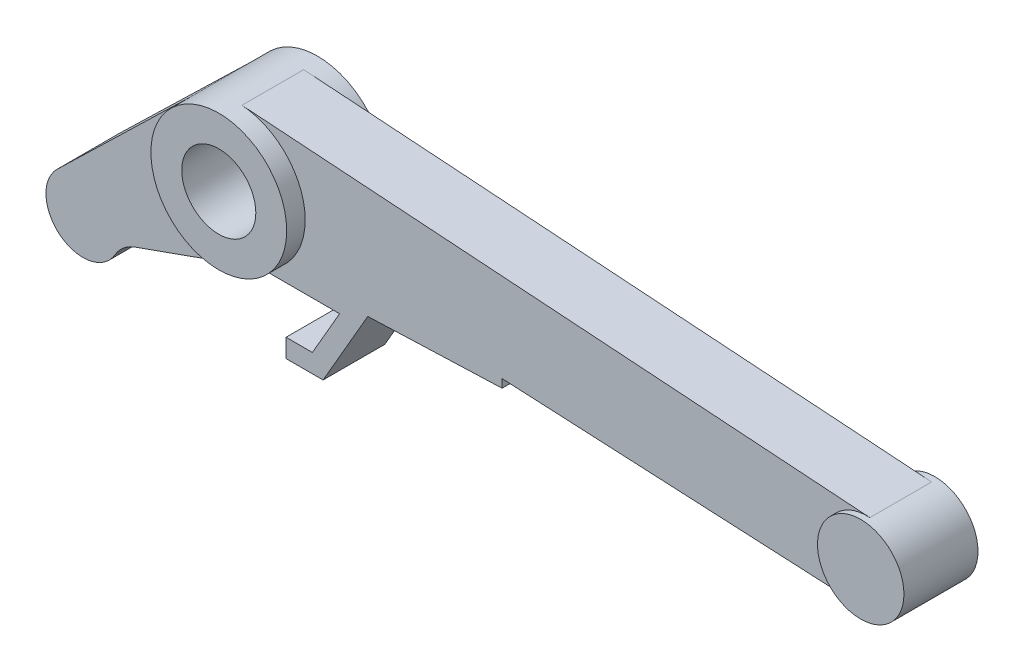
from build123d import *

# Parameters (mm, degrees)
SKETCH1_R               = 11
SKETCH1_R_2             = 6
BOSS_EXTRUDE1_DEPTH     = 8
BOSS_EXTRUDE2_DEPTH     = 6
BOSS_EXTRUDE3_DEPTH     = 5
CUT_EXTRUDE1_DEPTH      = 112.742355901
CUT_EXTRUDE1_DEPTH_BACK = 112.742355901
SKETCH3_R               = 6


with BuildPart() as part:
    # Sketch1 → Boss-Extrude1 (new, symmetric)
    with BuildSketch(Plane.XY):
        Circle(SKETCH1_R)
        Circle(SKETCH1_R_2, mode=Mode.SUBTRACT)
    extrude(amount=BOSS_EXTRUDE1_DEPTH, both=True)



with BuildPart() as body_2:
    # Sketch2 → Boss-Extrude2 (new, symmetric)
    with BuildSketch(Plane.XY):
        with BuildLine():
            ThreePointArc((109, -3), (107.116607967, 1.777062163), (102.479907739, 3.983529807))
            ThreePointArc((102.479907739, 3.983529807), (95.304638828, -0.957418601), (98.5, -9.062177826))
            ThreePointArc((98.5, -9.062177826), (105.5, -9.062177826), (109, -3))
        make_face()
    extrude(amount=BOSS_EXTRUDE2_DEPTH, both=True)


with BuildPart() as part_1:
    add(part.part)

    add(body_2.part)  # Boss-Extrude3 merges body 2
    # Sketch2<3> → Boss-Extrude3 (add, symmetric)
    with BuildSketch(Plane.XY):
        with BuildLine():
            ThreePointArc((0.754140733, 10.974118268), (-3.77780396, 10.330933997), (-7.655588843, 7.898858112))
            Line((-7.655588843, 7.898858112), (-29.175775732, -12.958549415))
            ThreePointArc((-29.175775732, -12.958549415), (-28.687665444, -22), (-19.801298619, -20.262598212))
            ThreePointArc((-19.801298619, -20.262598212), (-18.446505094, -18.651187263), (-16.618471977, -17.606962351))
            Line((-16.618471977, -17.606962351), (3.695770356, -10.360563762))
            Line((3.695770356, -10.360563762), (16.576592604, -10.360563762))
            Line((16.576592604, -10.360563762), (12.165962036, -18))
            Line((12.165962036, -18), (7.898012843, -18))
            Line((7.898012843, -18), (7.898012843, -21))
            Line((7.898012843, -21), (13.898012843, -21))
            Line((13.898012843, -21), (21.138158023, -8.459700694))
            Line((21.138158023, -8.459700694), (42.898012843, -7.651891962))
            Line((42.898012843, -7.651891962), (42.898012843, -6.302949113))
            Line((42.898012843, -6.302949113), (98.5, -9.062177826))
            ThreePointArc((98.5, -9.062177826), (95.304638828, -0.957418601), (102.479907739, 3.983529807))
            Line((102.479907739, 3.983529807), (0.754140733, 10.974118268))
        make_face()
    extrude(amount=BOSS_EXTRUDE3_DEPTH, both=True)

    # Sketch3 → Cut-Extrude1 (cut, two sides: drawn at the far end of the back side and taken through both)
    with BuildSketch(Plane.XY.offset(-CUT_EXTRUDE1_DEPTH_BACK)):
        Circle(SKETCH3_R)
    extrude(amount=CUT_EXTRUDE1_DEPTH + CUT_EXTRUDE1_DEPTH_BACK, mode=Mode.SUBTRACT)


solid = part_1.part
